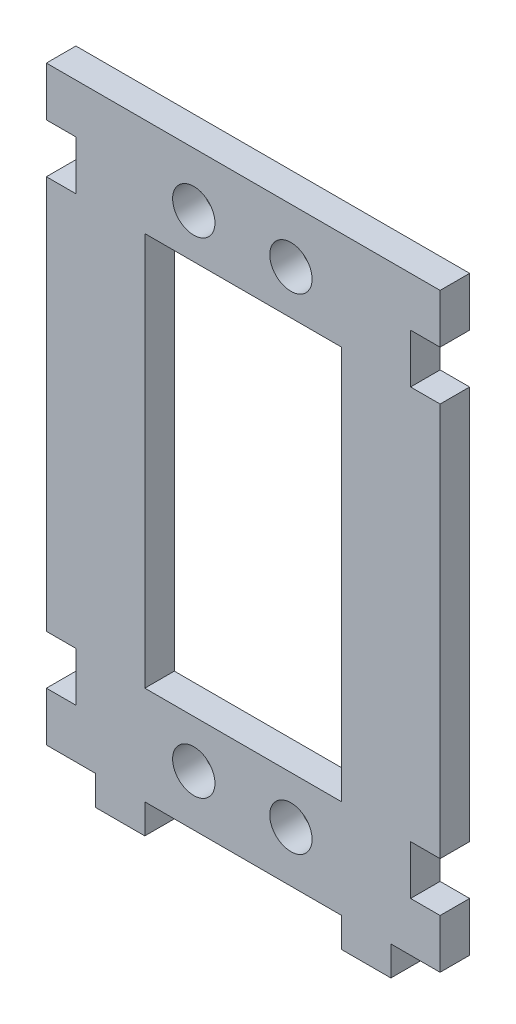
from build123d import *

# Parameters (mm, degrees)
SKETCH1_W           = 40
SKETCH1_H           = 60
BOSS_EXTRUDE1_DEPTH = 3
SKETCH2_R           = 2.15
SKETCH2_W           = 20
SKETCH2_H           = 40
CUT_EXTRUDE1_DEPTH  = 3
SKETCH3_W           = 5
SKETCH3_H           = 3
BOSS_EXTRUDE2_DEPTH = 3
SKETCH4_W           = 3
SKETCH4_H           = 5
CUT_EXTRUDE2_DEPTH  = 3


with BuildPart() as part:
    # Sketch1 → Boss-Extrude1 (new body)
    with BuildSketch(Plane.XY):
        Rectangle(SKETCH1_W, SKETCH1_H)
    extrude(amount=BOSS_EXTRUDE1_DEPTH)

    # Sketch2 → Cut-Extrude1 (cut)
    with BuildSketch(Plane.XY.offset(3)):
        with Locations((4.845, 24.49)):
            Circle(SKETCH2_R)
        with Locations((-5.025, 24.49)):
            Circle(SKETCH2_R)
        with Locations((-5.025, -24.81)):
            Circle(SKETCH2_R)
        with Locations((4.845, -24.81)):
            Circle(SKETCH2_R)
        Rectangle(SKETCH2_W, SKETCH2_H)
    extrude(amount=-CUT_EXTRUDE1_DEPTH, mode=Mode.SUBTRACT)

    # Sketch3 → Boss-Extrude2 (add)
    with BuildSketch(Plane.XZ.offset(30)):
        with Locations((12.5, 1.5)):
            Rectangle(SKETCH3_W, SKETCH3_H)
        with Locations((-12.5, 1.5)):
            Rectangle(SKETCH3_W, SKETCH3_H)
    extrude(amount=BOSS_EXTRUDE2_DEPTH)

    # Sketch4 → Cut-Extrude2 (cut)
    with BuildSketch(Plane(origin=(0, 0, 0), x_dir=(-1, 0, 0), z_dir=(0, 0, -1))):
        with Locations((-18.5, -22.5)):
            Rectangle(SKETCH4_W, SKETCH4_H)
        with Locations((-18.5, 22.5)):
            Rectangle(SKETCH4_W, SKETCH4_H)
        with Locations((18.5, 22.5)):
            Rectangle(SKETCH4_W, SKETCH4_H)
        with Locations((18.5, -22.5)):
            Rectangle(SKETCH4_W, SKETCH4_H)
    extrude(amount=-CUT_EXTRUDE2_DEPTH, mode=Mode.SUBTRACT)


solid = part.part
